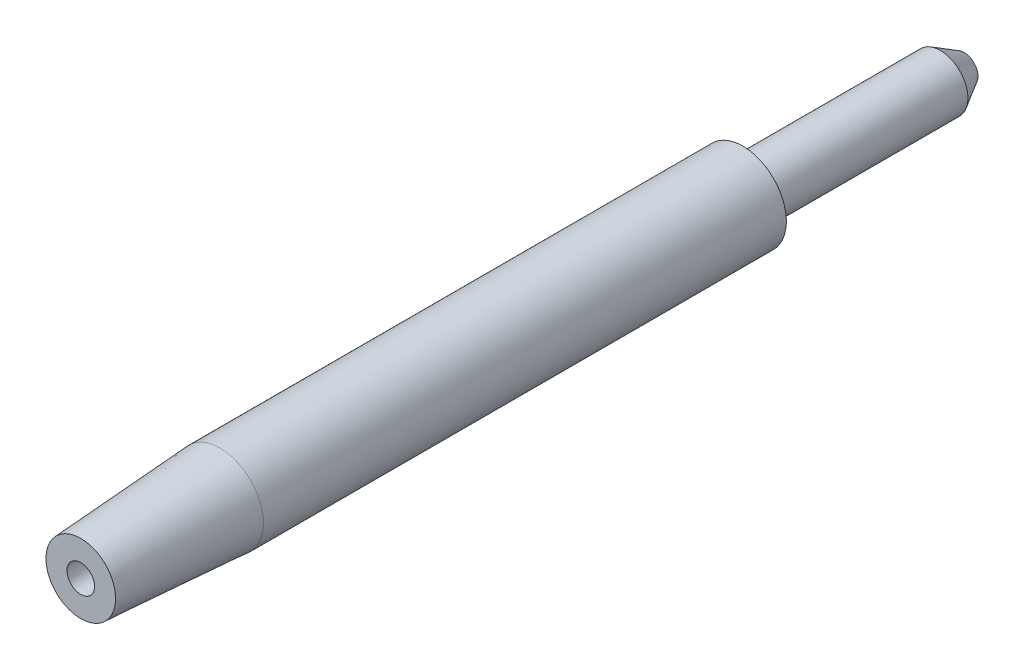
from build123d import *


with BuildPart() as part:
    # Sketch1 → Revolve1 (revolve)
    with BuildSketch(Plane(origin=(0, 0, 0), x_dir=(1, 0, 0), z_dir=(0, 1, 0))):
        Polygon((-5.47662222, 0.027079896), (-5.47662222, -50.766718553), (-6.68287222, -50.766718553), (-7.18287222, -42.766718553), (-7.18287222, -12.7), (-6.27037222, -12.7), (-6.27037222, -1.347735432), align=None)
    revolve(axis=Axis((-4.68287222, 0, -12.733281447), (0, 0, 1)))


solid = part.part
